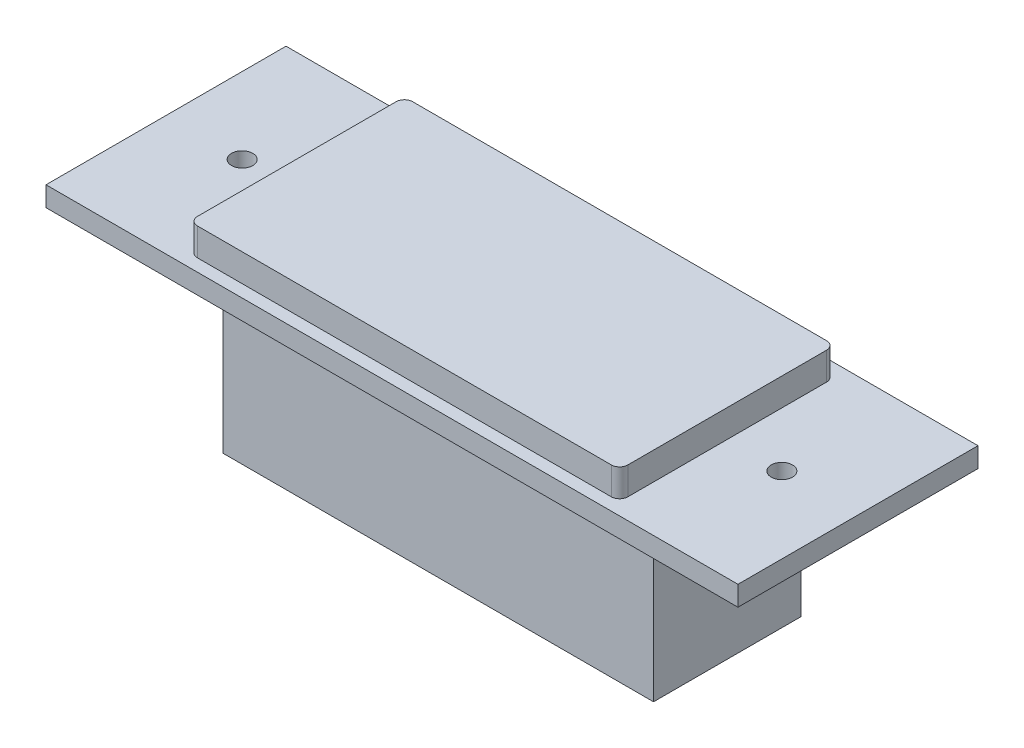
from build123d import *

# Parameters (mm, degrees)
SKETCH1_W             = 66.04
SKETCH1_H             = 33.02
BOSS_EXTRUDE1_DEPTH   = 4.2418
FILLET1_R             = 1.27
SKETCH2_W             = 106.172
SKETCH2_H             = 36.83
BOSS_EXTRUDE2_DEPTH   = 3.048
F_4_CLEARANCE_HOLE1_D = 3.2639
SKETCH6_W             = 66.04
SKETCH6_H             = 22.606
BOSS_EXTRUDE3_DEPTH   = 26.162


with BuildPart() as part:
    # Sketch1 → Boss-Extrude1 (new body)
    with BuildSketch(Plane(origin=(0, 0, 0), x_dir=(1, 0, 0), z_dir=(0, 1, 0))):
        Rectangle(SKETCH1_W, SKETCH1_H)
    extrude(amount=BOSS_EXTRUDE1_DEPTH)

    # Fillet1
    fillet1_edges = [part.edges().sort_by_distance(p)[0] for p in [
        (33.02, 2.1209, 16.51),
        (-33.02, 2.1209, 16.51),
        (-33.02, 2.1209, -16.51),
        (33.02, 2.1209, -16.51),
    ]]
    fillet(fillet1_edges, radius=FILLET1_R)

    # Sketch2 → Boss-Extrude2 (add)
    with BuildSketch(Plane.XZ):
        Rectangle(SKETCH2_W, SKETCH2_H)
    extrude(amount=BOSS_EXTRUDE2_DEPTH)

    # #4 Clearance Hole1 (through all)
    with Locations(Plane(origin=(0, 0, 0), x_dir=(1, 0, 0), z_dir=(0, 1, 0))):
        with Locations((-41.402, 0), (41.402, 0)):
            Hole(F_4_CLEARANCE_HOLE1_D / 2)

    # Sketch6 → Boss-Extrude3 (add)
    with BuildSketch(Plane.XZ.offset(3.048)):
        Rectangle(SKETCH6_W, SKETCH6_H)
    extrude(amount=BOSS_EXTRUDE3_DEPTH)


solid = part.part
